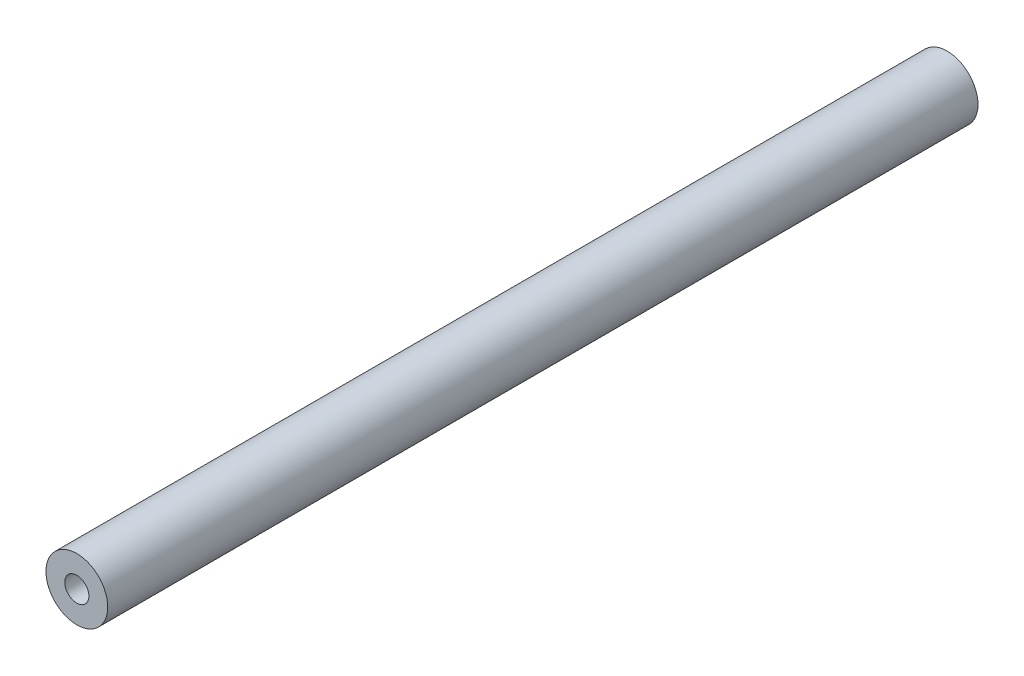
from build123d import *

# Parameters (mm, degrees)
SKETCH1_R           = 5.5
BOSS_EXTRUDE1_DEPTH = 155
SKETCH2_R           = 2.15
CUT_EXTRUDE1_DEPTH  = 150


with BuildPart() as part:
    # Sketch1 → Boss-Extrude1 (new body)
    with BuildSketch(Plane.XY):
        Circle(SKETCH1_R)
    extrude(amount=BOSS_EXTRUDE1_DEPTH)

    # Sketch2 → Cut-Extrude1 (cut)
    with BuildSketch(Plane.XY.offset(155)):
        Circle(SKETCH2_R)
    extrude(amount=-CUT_EXTRUDE1_DEPTH, mode=Mode.SUBTRACT)


solid = part.part
